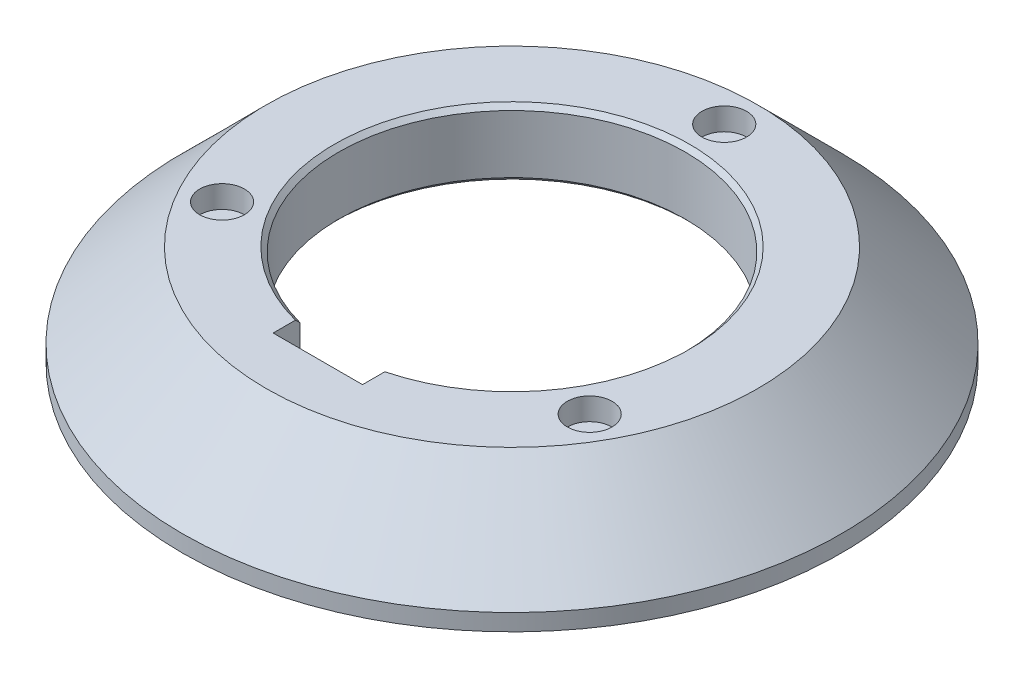
from build123d import *

# Parameters (mm, degrees)
CHAMFER_1_SIZE           = 2
SKETCH_2_R               = 10
CUT_EXTRUDE_1_DEPTH      = 10
PATTERN_CIRCULAR_1_COUNT = 3
CUT_EXTRUDE_2_DEPTH      = 214.395173329
CUT_EXTRUDE_2_DEPTH_BACK = 214.395173329
SKETCH_3_W               = 40
SKETCH_3_H               = 24.854018102


with BuildPart() as part:
    # Эскиз1 → Повернуть1 (revolve)
    with BuildSketch(Plane.XY, mode=Mode.PRIVATE) as revolve_1_sk:
        Polygon((77.5, 30), (77.5, 0), (117.5, 0), (132.5, -15), (147.5, -15), (147.5, -7.5), (110, 30), align=None)
    revolve(revolve_1_sk.sketch.rotate(Axis((0, 107.750556793, 0), (0, -1, 0)), 90), axis=Axis((0, 107.750556793, 0), (0, -1, 0)))

    # Фаска1
    chamfer_1_edges = [part.edges().sort_by_distance(p)[0] for p in [
        (0, 0, -77.5),
        (0, 30, -77.5),
    ]]
    chamfer(chamfer_1_edges, length=CHAMFER_1_SIZE)

    # Эскиз2 → Вырез-Вытянуть1 (cut)
    with BuildSketch(Plane(origin=(0, 30, 0), x_dir=(1, 0, 0), z_dir=(0, 1, 0))):
        with Locations(Location((0, 95, 0), (0, 0, 270))):
            Circle(SKETCH_2_R)
    cut_extrude_1 = extrude(amount=-CUT_EXTRUDE_1_DEPTH, mode=Mode.SUBTRACT)

    # Круговой массив1: Вырез-Вытянуть1 ×3 about axis
    pattern_circular_1_axis = Axis((0, 0, 0), (0, 1, 0))
    for i in range(1, PATTERN_CIRCULAR_1_COUNT):
        add(cut_extrude_1.rotate(pattern_circular_1_axis, i * 360 / PATTERN_CIRCULAR_1_COUNT), mode=Mode.SUBTRACT)

    # Эскиз3 → Вырез-Вытянуть2 (cut, two sides: drawn at the far end of the back side and taken through both)
    with BuildSketch(Plane(origin=(0, 30, 0), x_dir=(1, 0, 0), z_dir=(0, 1, 0)).offset(-CUT_EXTRUDE_2_DEPTH_BACK)):
        with Locations((0, -74.472990949)):
            Rectangle(SKETCH_3_W, SKETCH_3_H)
    extrude(amount=CUT_EXTRUDE_2_DEPTH + CUT_EXTRUDE_2_DEPTH_BACK, mode=Mode.SUBTRACT)


solid = part.part
